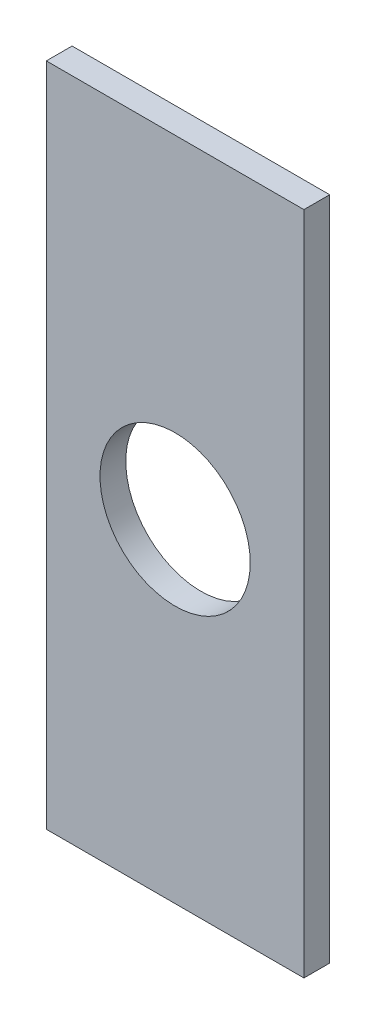
from build123d import *

# Parameters (mm, degrees)
SKETCH_1_W      = 120
SKETCH_1_H      = 310
SKETCH_1_R      = 35
EXTRUDE_1_DEPTH = 12


with BuildPart() as part:
    # 草图1 → 凸台-拉伸1 (new body)
    with BuildSketch(Plane.XY):
        Rectangle(SKETCH_1_W, SKETCH_1_H)
        Circle(SKETCH_1_R, mode=Mode.SUBTRACT)
    extrude(amount=EXTRUDE_1_DEPTH)


solid = part.part
